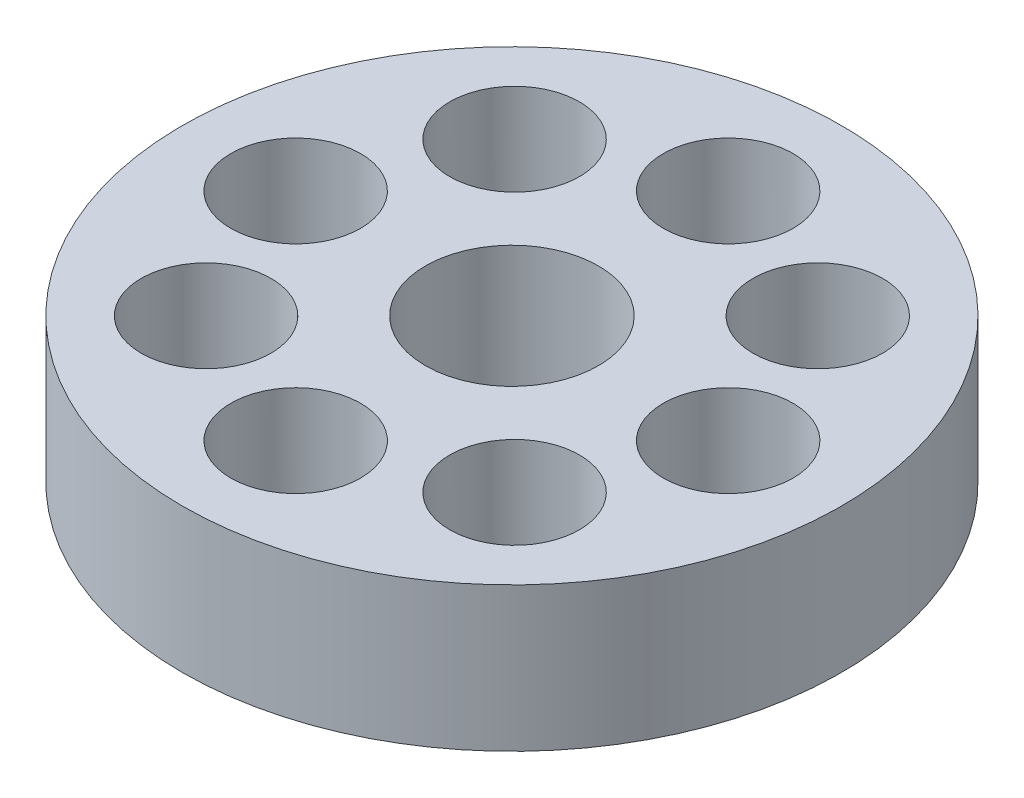
from build123d import *

# Parameters (mm, degrees)
SKETCH1_R           = 114.3
SKETCH1_R_2         = 22.5
SKETCH1_R_3         = 30
BOSS_EXTRUDE1_DEPTH = 50
CUT_EXTRUDE1_START  = -35
SKETCH2_R           = 90
SKETCH2_R_2         = 60
CUT_EXTRUDE1_DEPTH  = 20


with BuildPart() as part:
    # Sketch1 → Boss-Extrude1 (new body)
    with BuildSketch(Plane(origin=(0, 0, 0), x_dir=(1, 0, 0), z_dir=(0, 1, 0))):
        with Locations(Location((0, 0, 0), (0, 0, 270))):
            Circle(SKETCH1_R)
        with Locations(Location((75, 0, 0), (0, 0, 270))):
            Circle(SKETCH1_R_2, mode=Mode.SUBTRACT)
        with Locations(Location((53.031031744, 53.03498536, 0), (0, 0, 270))):
            Circle(SKETCH1_R_2, mode=Mode.SUBTRACT)
        with Locations(Location((0, 75, 0), (0, 0, 270))):
            Circle(SKETCH1_R_2, mode=Mode.SUBTRACT)
        with Locations(Location((-52.573136336, 53.488927226, 0), (0, 0, 270))):
            Circle(SKETCH1_R_2, mode=Mode.SUBTRACT)
        with Locations(Location((-75, 0, 0), (0, 0, 270))):
            Circle(SKETCH1_R_2, mode=Mode.SUBTRACT)
        with Locations(Location((-53.03498536, -53.031031744, 0), (0, 0, 270))):
            Circle(SKETCH1_R_2, mode=Mode.SUBTRACT)
        with Locations(Location((0, -75, 0), (0, 0, 270))):
            Circle(SKETCH1_R_2, mode=Mode.SUBTRACT)
        with Locations(Location((53.488927226, -52.573136336, 0), (0, 0, 270))):
            Circle(SKETCH1_R_2, mode=Mode.SUBTRACT)
        with Locations(Location((0, 0, 0), (0, 0, 270))):
            Circle(SKETCH1_R_3, mode=Mode.SUBTRACT)
    extrude(amount=BOSS_EXTRUDE1_DEPTH)

    # Sketch2 → Cut-Extrude1 (cut)
    with BuildSketch(Plane(origin=(0, 50, 0), x_dir=(1, 0, 0), z_dir=(0, 1, 0)).offset(CUT_EXTRUDE1_START)):
        Circle(SKETCH2_R)
        Circle(SKETCH2_R_2, mode=Mode.SUBTRACT)
    extrude(amount=-CUT_EXTRUDE1_DEPTH, mode=Mode.SUBTRACT)


solid = part.part
